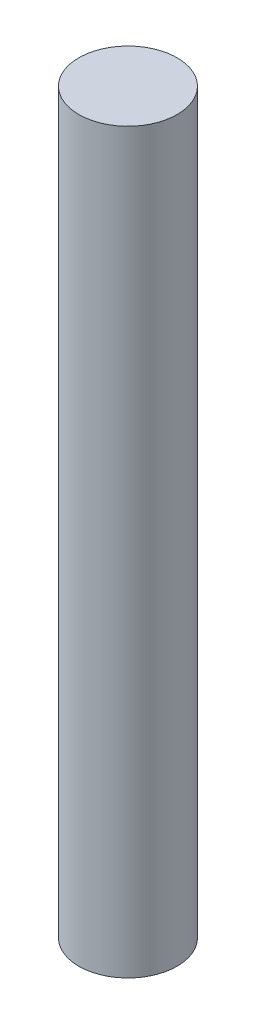
from build123d import *

# Parameters (mm, degrees)
SKETCH1_R           = 2.5
BOSS_EXTRUDE1_DEPTH = 37.5


with BuildPart() as part:
    # Sketch1 → Boss-Extrude1 (new body)
    with BuildSketch(Plane(origin=(0, 0, 0), x_dir=(1, 0, 0), z_dir=(0, 1, 0))):
        with Locations(Location((0, 0, 0), (0, 0, 270))):
            Circle(SKETCH1_R)
    extrude(amount=BOSS_EXTRUDE1_DEPTH)


solid = part.part
